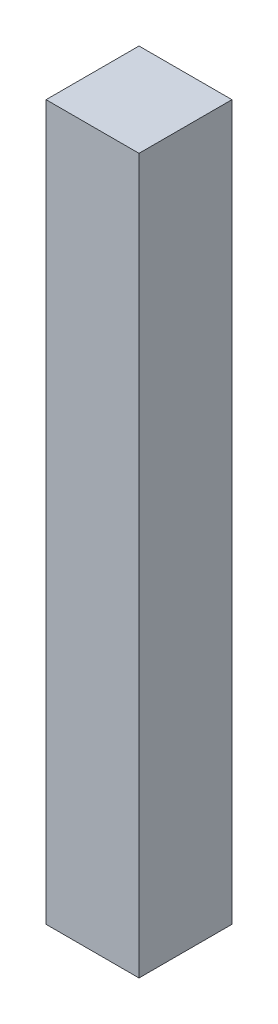
from build123d import *

# Parameters (mm, degrees)
BOSS_EXTRUDE1_DEPTH      = 146
BOSS_EXTRUDE1_DEPTH_BACK = 146
SKETCH1_W                = 38
SKETCH1_H                = 38


with BuildPart() as part:
    # Sketch1 → Boss-Extrude1 (new, two sides: drawn at the far end of the back side and taken through both)
    with BuildSketch(Plane(origin=(0, 0, 0), x_dir=(1, 0, 0), z_dir=(0, 1, 0)).offset(-BOSS_EXTRUDE1_DEPTH_BACK)):
        Rectangle(SKETCH1_W, SKETCH1_H)
    extrude(amount=BOSS_EXTRUDE1_DEPTH + BOSS_EXTRUDE1_DEPTH_BACK)


solid = part.part
